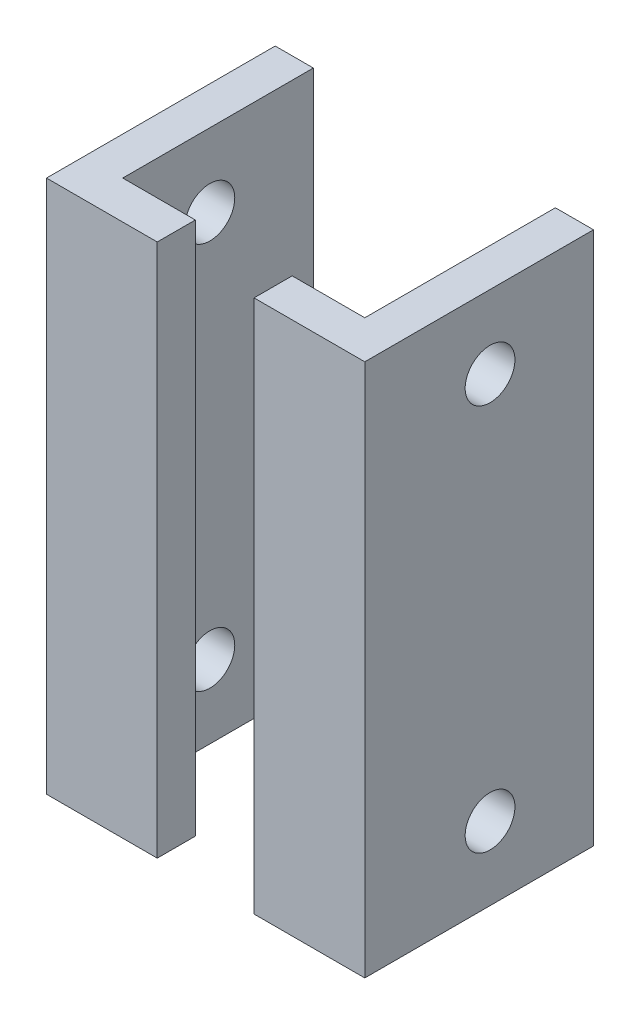
from build123d import *

# Parameters (mm, degrees)
SKETCH1_W           = 30
SKETCH1_H           = 70
SKETCH1_R           = 3.2639
BOSS_EXTRUDE1_DEPTH = 5
SKETCH2_W           = 5
SKETCH2_H           = 70
BOSS_EXTRUDE2_DEPTH = 9.525


with BuildPart() as part:
    # Sketch1 → Boss-Extrude1 (new body)
    with BuildSketch(Plane(origin=(15.875, 0, 0), x_dir=(0, 0, -1), z_dir=(1, 0, 0))):
        with Locations((-34.45, 279.4)):
            Rectangle(SKETCH1_W, SKETCH1_H)
        with Locations((-33.02, 254)):
            Circle(SKETCH1_R, mode=Mode.SUBTRACT)
        with Locations((-33.02, 304.8)):
            Circle(SKETCH1_R, mode=Mode.SUBTRACT)
    extrude(amount=BOSS_EXTRUDE1_DEPTH)

    # Sketch2 → Boss-Extrude2 (add)
    with BuildSketch(Plane.ZY.offset(-15.875)):
        with Locations((46.95, 279.4)):
            Rectangle(SKETCH2_W, SKETCH2_H)
    extrude(amount=BOSS_EXTRUDE2_DEPTH)


with BuildPart() as body_2:
    # Mirror2: mirrored copy
    add(part.part.mirror(Plane(origin=(0, 0, 0), x_dir=(0, 0, 1), z_dir=(1, 0, 0))))


solid = Compound([part.part, body_2.part])
